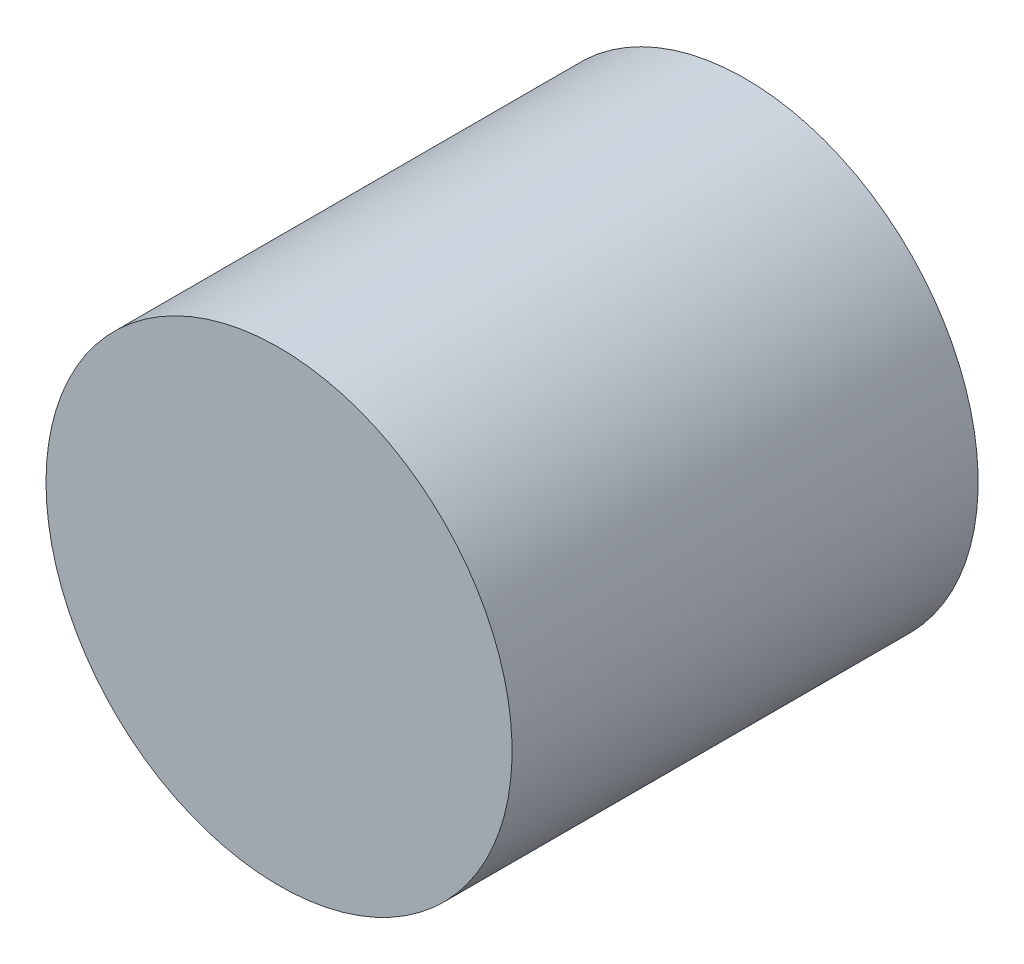
from build123d import *

# Parameters (mm, degrees)
SKETCH1_R      = 30
EXTRUDE1_DEPTH = 60


with BuildPart() as part:
    # Sketch1 → Extrude1 (new body)
    with BuildSketch(Plane.XY):
        with Locations(Location((0, 0, 0), (0, 0, 180))):
            Circle(SKETCH1_R)
    extrude(amount=EXTRUDE1_DEPTH)


solid = part.part
